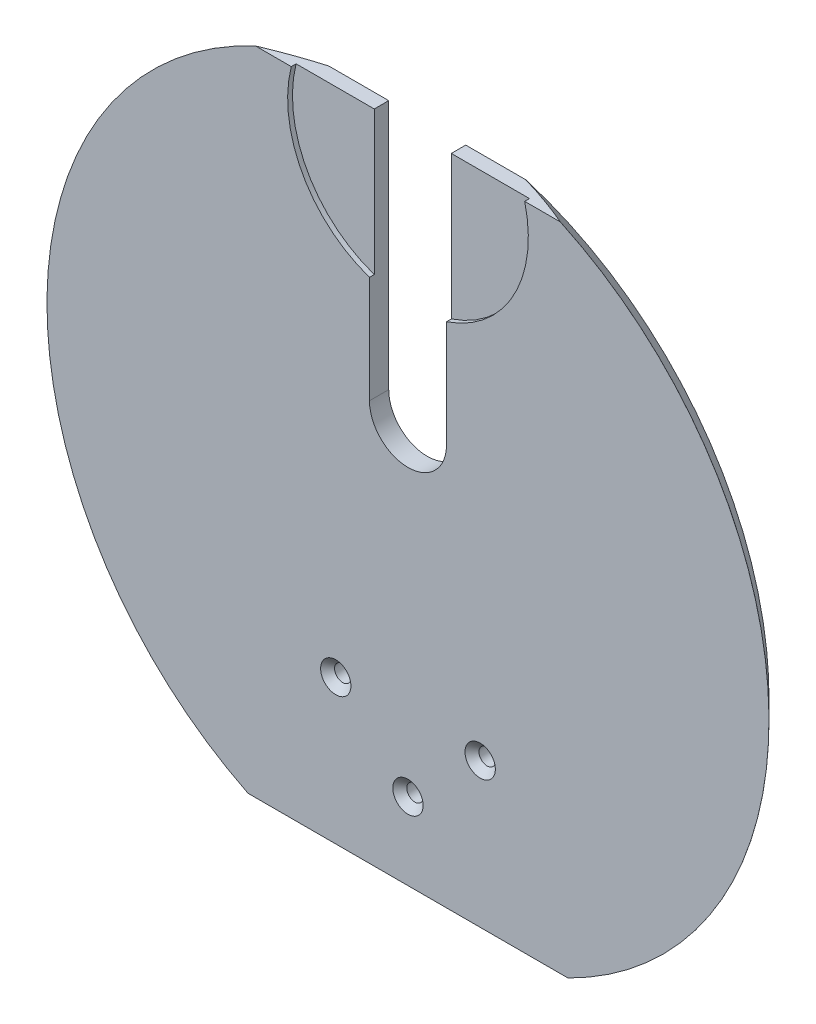
from build123d import *

# Parameters (mm, degrees)
BOSS_EXTRUDE2_DEPTH                                 = 4
CSK_FOR_M3_COUNTERSUNK_FLAT_HEAD_SCREW1_D           = 3.4
CSK_FOR_M3_COUNTERSUNK_FLAT_HEAD_SCREW1_CSINK_D     = 6.3
CSK_FOR_M3_COUNTERSUNK_FLAT_HEAD_SCREW1_CSINK_ANGLE = 90
CUT_EXTRUDE1_REACH                                  = 103.316
SKETCH5_R                                           = 25
CUT_EXTRUDE2_DEPTH                                  = 1
CHAMFER3_SIZE                                       = 3.99


with BuildPart() as part:
    # Sketch1 → Boss-Extrude2 (new body)
    with BuildSketch(Plane.XY):
        with BuildLine():
            Line((-33.226495452, -67.238381896), (33.226495452, -67.238381896))
            ThreePointArc((33.226495452, -67.238381896), (74.994830614, 0.880557322), (31.638584039, 68))
            Line((31.638584039, 68), (-31.638584039, 68))
            ThreePointArc((-31.638584039, 68), (-74.994830614, 0.880557322), (-33.226495452, -67.238381896))
        make_face()
    extrude(amount=BOSS_EXTRUDE2_DEPTH)

    # CSK for M3 Countersunk Flat Head Screw1 (through all)
    with Locations(Plane.XY.offset(4)):
        with Locations((-15, -37.238381896), (0, -51.238381896), (15, -37.238381896)):
            CounterSinkHole(CSK_FOR_M3_COUNTERSUNK_FLAT_HEAD_SCREW1_D / 2, CSK_FOR_M3_COUNTERSUNK_FLAT_HEAD_SCREW1_CSINK_D / 2, counter_sink_angle=CSK_FOR_M3_COUNTERSUNK_FLAT_HEAD_SCREW1_CSINK_ANGLE)

    # Sketch4 → Cut-Extrude1 (cut, up to next)
    with BuildSketch(Plane.XY.offset(4), mode=Mode.PRIVATE) as cut_extrude1_sk1:
        with BuildLine():
            Line((-8, 16), (-8, 68))
            Line((-8, 68), (8, 68))
            Line((8, 68), (8, 16))
            ThreePointArc((8, 16), (0, 8), (-8, 16))
        make_face()
    cut_extrude1_tool1 = extrude(cut_extrude1_sk1.sketch, amount=-CUT_EXTRUDE1_REACH, mode=Mode.PRIVATE) & part.part
    add(cut_extrude1_tool1.solids().sort_by_distance((0, 38.831056, 4))[0], mode=Mode.SUBTRACT)

    # Sketch5 → Cut-Extrude2 (cut)
    with BuildSketch(Plane.XY.offset(4)):
        with Locations((0, 61.9)):
            Circle(SKETCH5_R)
    extrude(amount=-CUT_EXTRUDE2_DEPTH, mode=Mode.SUBTRACT)

    # Chamfer3
    chamfer3_edges = [part.edges().sort_by_distance(p)[0] for p in [
        (74.994830614, 0.880557322, 0),
        (-74.994830614, 0.880557322, 0),
    ]]
    chamfer(chamfer3_edges, length=CHAMFER3_SIZE)


solid = part.part
